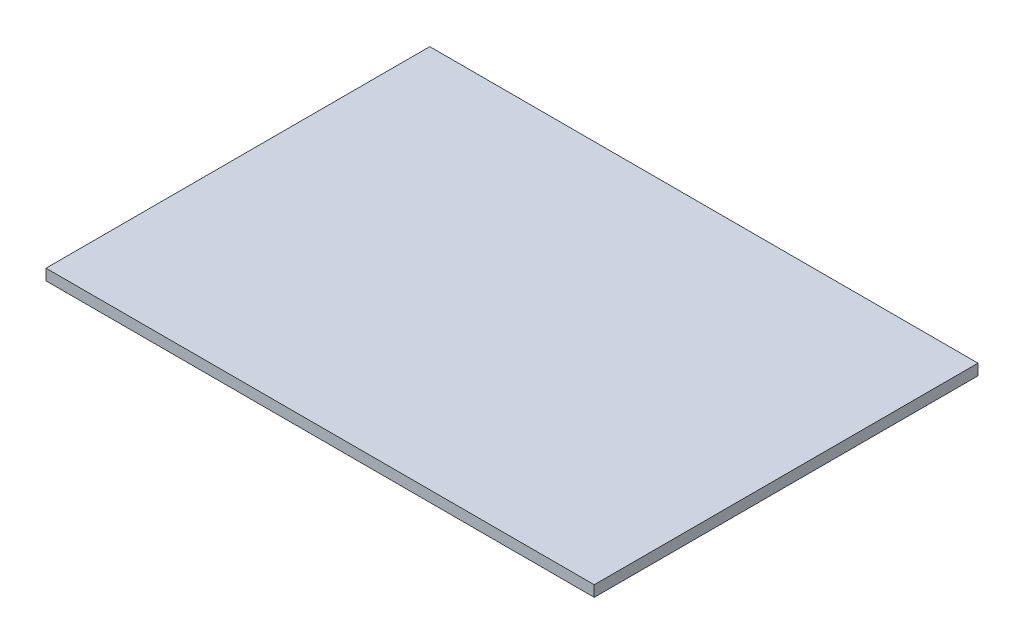
from build123d import *

# Parameters (mm, degrees)
SKETCH1_W           = 100
SKETCH1_H           = 70
BOSS_EXTRUDE1_DEPTH = 2


with BuildPart() as part:
    # Sketch1 → Boss-Extrude1 (new body)
    with BuildSketch(Plane(origin=(0, 0, 0), x_dir=(1, 0, 0), z_dir=(0, 1, 0))):
        Rectangle(SKETCH1_W, SKETCH1_H)
    extrude(amount=BOSS_EXTRUDE1_DEPTH)


solid = part.part
